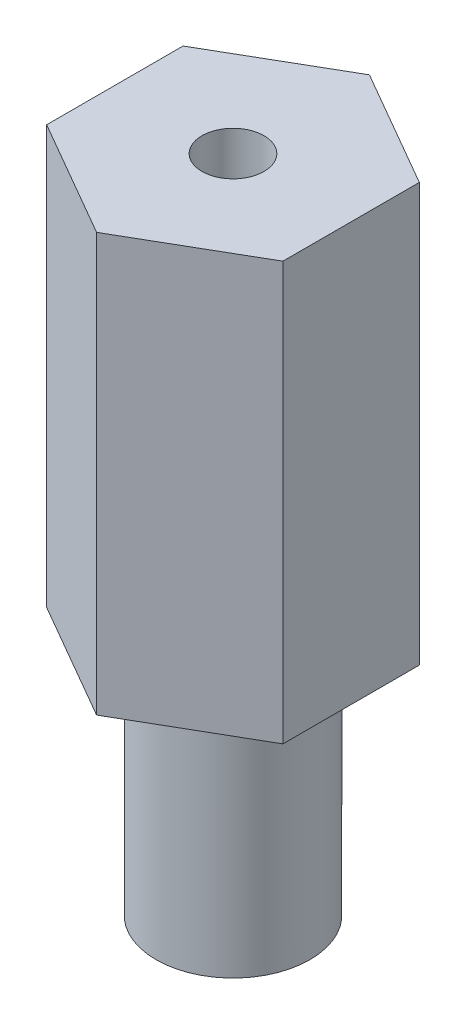
from build123d import *

# Parameters (mm, degrees)
BOSS_EXTRUDE1_DEPTH = 8
SKETCH2_R           = 1.4732
BOSS_EXTRUDE2_DEPTH = 4.6228
SKETCH3_R           = 0.593671867
CUT_EXTRUDE1_DEPTH  = 2.54


with BuildPart() as part:
    # Sketch1 → Boss-Extrude1 (new body)
    with BuildSketch(Plane(origin=(0, 0, 0), x_dir=(1, 0, 0), z_dir=(0, 1, 0))):
        Polygon((2.2606, 1.305158019), (0, 2.610316037), (-2.2606, 1.305158019), (-2.2606, -1.305158019), (0, -2.610316037), (2.2606, -1.305158019), align=None)
    extrude(amount=BOSS_EXTRUDE1_DEPTH)

    # Sketch2 → Boss-Extrude2 (add)
    with BuildSketch(Plane.XZ):
        with Locations(Location((0, 0, 0), (0, 0, 90))):
            Circle(SKETCH2_R)
    extrude(amount=BOSS_EXTRUDE2_DEPTH)

    # Sketch3 → Cut-Extrude1 (cut)
    with BuildSketch(Plane(origin=(0, 8, 0), x_dir=(1, 0, 0), z_dir=(0, 1, 0))):
        with Locations(Location((0, 0, 0), (0, 0, 270))):
            Circle(SKETCH3_R)
    extrude(amount=-CUT_EXTRUDE1_DEPTH, mode=Mode.SUBTRACT)


solid = part.part
